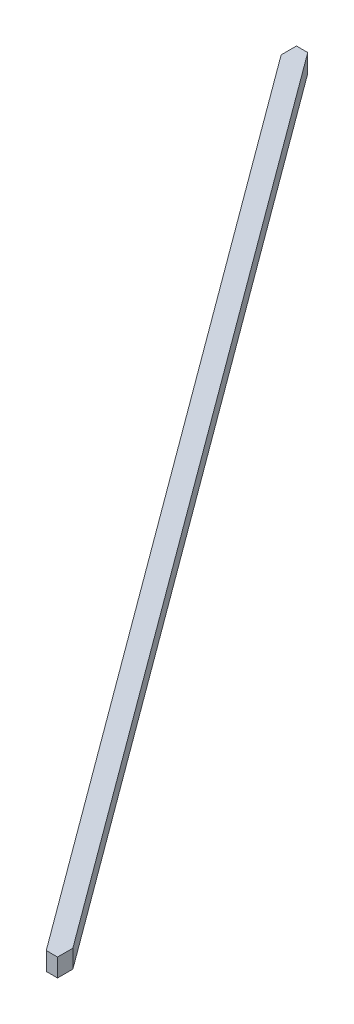
from build123d import *

# Parameters (mm, degrees)
BOSS_EXTRUDE2_DEPTH = 20


with BuildPart() as part:
    # Sketch3 → Boss-Extrude2 (new body)
    with BuildSketch(Plane(origin=(0, 0, 0), x_dir=(1, 0, 0), z_dir=(0, 1, 0))):
        Polygon((0, 1000), (12.422435349, 1000), (737, 16.855407529), (737, 0), (724.577564651, 0), (0, 983.144592471), align=None)
    extrude(amount=BOSS_EXTRUDE2_DEPTH)


solid = part.part
